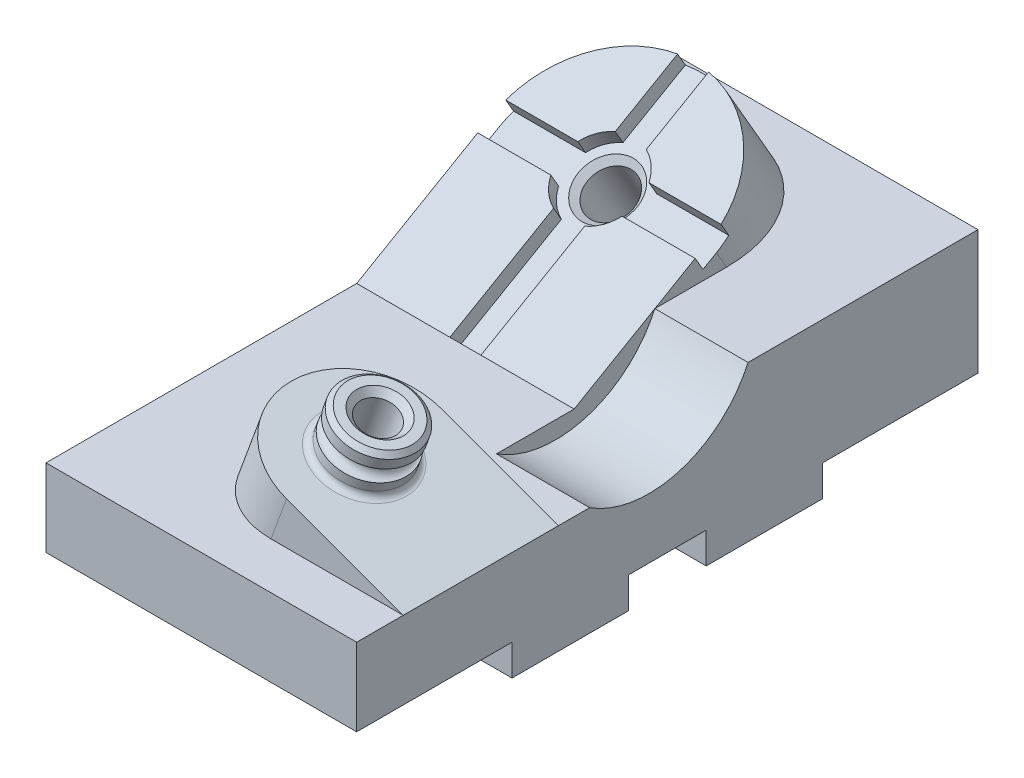
from build123d import *

# Parameters (mm, degrees)
BOSS_EXTRUDE1_DEPTH     = 100
CUT_EXTRUDE1_DEPTH      = 30
BOSS_EXTRUDE2_START     = -15
BOSS_EXTRUDE2_DEPTH     = 50
CUT_EXTRUDE2_REACH      = 226.87
SKETCH5_R               = 12.5
BOSS_EXTRUDE4_DEPTH     = 15
SKETCH7_R               = 6
CUT_EXTRUDE4_DEPTH      = 228.547988513
FILLET1_R               = 2
CHAMFER1_SIZE           = 2
CHAMFER2_SIZE           = 1.5
BOSS_EXTRUDE5_DEPTH     = 70
CUT_EXTRUDE5_REACH      = 232.227
CUT_EXTRUDE6_DEPTH      = 5
CUT_EXTRUDE7_DEPTH      = 230.919504684
CUT_EXTRUDE7_DEPTH_BACK = 230.919504684
SKETCH17_R              = 7.5
CHAMFER3_SIZE           = 2


with BuildPart() as part:
    # Sketch1 → Boss-Extrude1 (new body)
    with BuildSketch(Plane(origin=(0, 0, 0), x_dir=(0, 0, -1), z_dir=(1, 0, 0))):
        Polygon((0, 0), (50, 0), (50, -10), (87.5, -10), (87.5, 0), (112.5, 0), (112.5, -10), (150, -10), (150, 0), (200, 0), (200, 40), (125.980762114, 40), (100, 25), (0, 25), align=None)
    extrude(amount=BOSS_EXTRUDE1_DEPTH)

    # Sketch2 → Cut-Extrude1 (cut)
    with BuildSketch(Plane(origin=(100, 0, 0), x_dir=(0, 0, -1), z_dir=(1, 0, 0))):
        with BuildLine():
            Line((100, 25), (75, 25))
            ThreePointArc((75, 25), (103.939266476, 20.77821286), (125.980762114, 40))
            Line((125.980762114, 40), (100, 25))
        make_face()
    extrude(amount=-CUT_EXTRUDE1_DEPTH, mode=Mode.SUBTRACT)

    # Sketch3 → Boss-Extrude2 (add)
    with BuildSketch(Plane.XY.offset(BOSS_EXTRUDE2_START)):
        Polygon((100, 25), (30.828444789, 25), (38.919979649, 47.231309316), align=None)
    extrude(amount=-BOSS_EXTRUDE2_DEPTH)

    # Cut-Extrude2: up to this plane
    cut_extrude2_end = Plane(origin=(100, 25, 0), z_dir=(0, -1, 0))
    # Sketch4 → Cut-Extrude2 (cut, up to the surface)
    with BuildSketch(Plane(origin=(19.732622965, 54.214936023, 0), x_dir=(0.9396926207859106, -0.3420201433256628, 0), z_dir=(0.34202014332566283, 0.9396926207859106, 0)), mode=Mode.PRIVATE) as cut_extrude2_sk1:
        with BuildLine():
            ThreePointArc((20.418758495, 40), (27.741088966, 57.67766953), (45.418758495, 65))
            Line((45.418758495, 65), (20.418758495, 65))
            Line((20.418758495, 65), (20.418758495, 40))
        make_face()
    cut_extrude2_tool1 = split(extrude(cut_extrude2_sk1.sketch, amount=-CUT_EXTRUDE2_REACH, mode=Mode.PRIVATE), bisect_by=cut_extrude2_end, keep=Keep.BOTH, mode=Mode.PRIVATE)
    add(cut_extrude2_tool1.solids().sort_by_distance((44.16741, 45.321401, -59.415802))[0], mode=Mode.SUBTRACT)
    # Sketch4 → Cut-Extrude2 (cut, up to the surface)
    with BuildSketch(Plane(origin=(19.732622965, 54.214936023, 0), x_dir=(0.9396926207859106, -0.3420201433256628, 0), z_dir=(0.34202014332566283, 0.9396926207859106, 0)), mode=Mode.PRIVATE) as cut_extrude2_sk2:
        with BuildLine():
            ThreePointArc((45.418758495, 15), (27.741088966, 22.32233047), (20.418758495, 40))
            Line((20.418758495, 40), (20.418758495, 15))
            Line((20.418758495, 15), (45.418758495, 15))
        make_face()
    cut_extrude2_tool2 = split(extrude(cut_extrude2_sk2.sketch, amount=-CUT_EXTRUDE2_REACH, mode=Mode.PRIVATE), bisect_by=cut_extrude2_end, keep=Keep.BOTH, mode=Mode.PRIVATE)
    add(cut_extrude2_tool2.solids().sort_by_distance((44.16741, 45.321401, -20.584198))[0], mode=Mode.SUBTRACT)

    # Sketch5 → Boss-Extrude4 (add)
    with BuildSketch(Plane(origin=(19.732622965, 54.214936023, 0), x_dir=(0.9396926207859106, -0.3420201433256628, 0), z_dir=(0.34202014332566283, 0.9396926207859106, 0))):
        with Locations(Location((45.418758495, 40, 0), (0, 0, 180))):
            Circle(SKETCH5_R)
    extrude(amount=BOSS_EXTRUDE4_DEPTH)

    # Sketch7 → Cut-Extrude4 (cut, through all)
    with BuildSketch(Plane(origin=(24.862925115, 68.310325335, 0), x_dir=(0.9396926207859105, -0.3420201433256629, 0), z_dir=(0.34202014332566294, 0.9396926207859106, 0))):
        with Locations(Location((45.418758495, 40, 0), (0, 0, 180))):
            Circle(SKETCH7_R)
    extrude(amount=-CUT_EXTRUDE4_DEPTH, mode=Mode.SUBTRACT)

    # Fillet1
    fillet1_edges = [part.edges().sort_by_distance(p)[0] for p in [
        (74.158452928, 34.405553941, -40),
    ]]
    fillet(fillet1_edges, radius=FILLET1_R)

    # Chamfer1
    chamfer1_edges = [part.edges().sort_by_distance(p)[0] for p in [
        (73.180753043, 50.724074185, -40),
    ]]
    chamfer(chamfer1_edges, length=CHAMFER1_SIZE)

    # Sketch11 → Cut-Revolve1 (revolve, cut)
    with BuildSketch(Plane(origin=(42.679672203, -15.53413029, 0), x_dir=(0.34202014332566294, 0.9396926207859105, 0), z_dir=(0.9396926207859105, -0.342020143325663, 0)), mode=Mode.PRIVATE) as cut_revolve1_sk:
        with BuildLine():
            Line((67.694329852, -27.5), (62.694329852, -27.5))
            ThreePointArc((62.694329852, -27.5), (65.194329852, -30), (67.694329852, -27.5))
        make_face()
    revolve(cut_revolve1_sk.sketch.rotate(Axis((43.396560119, -13.564496931, -40), (0.34202014332566283, 0.9396926207859105, 0)), 90), axis=Axis((43.396560119, -13.564496931, -40), (0.34202014332566283, 0.9396926207859105, 0)), mode=Mode.SUBTRACT)

    # Chamfer2
    chamfer2_edges = [part.edges().sort_by_distance(p)[0] for p in [
        (79.288755078, 48.500943253, -40),
    ]]
    chamfer(chamfer2_edges, length=CHAMFER2_SIZE)

    # Sketch13 → Boss-Extrude5 (add)
    with BuildSketch(Plane.ZY):
        Polygon((-125.980762114, 40), (-173.612159322, 67.5), (-189.489291724, 40), align=None)
    extrude(amount=-BOSS_EXTRUDE5_DEPTH)

    # Cut-Extrude5: up to this plane
    cut_extrude5_end = Plane(origin=(100, 40, -200), z_dir=(0, -1, 0))
    # Sketch14 → Cut-Extrude5 (cut, up to the surface)
    with BuildSketch(Plane(origin=(0, -24.551270189, -14.174682453), x_dir=(1, 0, 0), z_dir=(0, 0.8660254037844378, 0.5000000000000016)), mode=Mode.PRIVATE) as cut_extrude5_sk1:
        with BuildLine():
            Line((70, 184.102540378), (35, 184.102540378))
            ThreePointArc((35, 184.102540378), (59.748737342, 173.85127772), (70, 149.102540378))
            Line((70, 149.102540378), (70, 184.102540378))
        make_face()
    cut_extrude5_tool1 = split(extrude(cut_extrude5_sk1.sketch, amount=-CUT_EXTRUDE5_REACH, mode=Mode.PRIVATE), bisect_by=cut_extrude5_end, keep=Keep.BOTH, mode=Mode.PRIVATE)
    add(cut_extrude5_tool1.solids().sort_by_distance((62.182122, 63.591061, -166.841678))[0], mode=Mode.SUBTRACT)
    # Sketch14 → Cut-Extrude5 (cut, up to the surface)
    with BuildSketch(Plane(origin=(0, -24.551270189, -14.174682453), x_dir=(1, 0, 0), z_dir=(0, 0.8660254037844378, 0.5000000000000016)), mode=Mode.PRIVATE) as cut_extrude5_sk2:
        with BuildLine():
            Line((0, 184.102540378), (0, 149.102540378))
            ThreePointArc((0, 149.102540378), (10.251262658, 173.85127772), (35, 184.102540378))
            Line((35, 184.102540378), (0, 184.102540378))
        make_face()
    cut_extrude5_tool2 = split(extrude(cut_extrude5_sk2.sketch, amount=-CUT_EXTRUDE5_REACH, mode=Mode.PRIVATE), bisect_by=cut_extrude5_end, keep=Keep.BOTH, mode=Mode.PRIVATE)
    add(cut_extrude5_tool2.solids().sort_by_distance((7.817878, 63.591061, -166.841678))[0], mode=Mode.SUBTRACT)

    # Sketch15 → Cut-Extrude6 (cut)
    with BuildSketch(Plane(origin=(0, -24.551270189, -14.174682453), x_dir=(1, 0, 0), z_dir=(0, 0.8660254037844378, 0.5000000000000016))):
        with BuildLine():
            ThreePointArc((40, 183.74355653), (35, 184.102540378), (30, 183.74355653))
            Line((30, 183.74355653), (30, 160.558979616))
            ThreePointArc((30, 160.558979616), (26.161165235, 157.941375143), (23.543560763, 154.102540378))
            Line((23.543560763, 154.102540378), (0.358983849, 154.102540378))
            ThreePointArc((0.358983849, 154.102540378), (0.08986132, 151.608975566), (0, 149.102540378))
            Line((0, 149.102540378), (0, 144.102540378))
            Line((0, 144.102540378), (23.543560763, 144.102540378))
            ThreePointArc((23.543560763, 144.102540378), (26.161165235, 140.263705614), (30, 137.646101141))
            Line((30, 137.646101141), (30, 99.102540378))
            Line((30, 99.102540378), (40, 99.102540378))
            Line((40, 99.102540378), (40, 137.646101141))
            ThreePointArc((40, 137.646101141), (43.838834765, 140.263705614), (46.456439237, 144.102540378))
            Line((46.456439237, 144.102540378), (70, 144.102540378))
            Line((70, 144.102540378), (70, 149.102540378))
            ThreePointArc((70, 149.102540378), (69.91013868, 151.608975566), (69.641016151, 154.102540378))
            Line((69.641016151, 154.102540378), (46.456439237, 154.102540378))
            ThreePointArc((46.456439237, 154.102540378), (43.838834765, 157.941375143), (40, 160.558979616))
            Line((40, 160.558979616), (40, 183.74355653))
        make_face()
    extrude(amount=-CUT_EXTRUDE6_DEPTH, mode=Mode.SUBTRACT)

    # Sketch17 → Cut-Extrude7 (cut, two sides: drawn at the far end of the back side and taken through both)
    with BuildSketch(Plane(origin=(0, -28.881397208, -16.674682453), x_dir=(1, 0, 0), z_dir=(0, 0.8660254037844378, 0.5000000000000016)).offset(-CUT_EXTRUDE7_DEPTH_BACK)):
        with Locations(Location((35, 149.102540378, 0), (0, 0, 270))):
            Circle(SKETCH17_R)
    extrude(amount=CUT_EXTRUDE7_DEPTH + CUT_EXTRUDE7_DEPTH_BACK, mode=Mode.SUBTRACT)

    # Chamfer3
    chamfer3_edges = [part.edges().sort_by_distance(p)[0] for p in [
        (35, 49.419872981, -152.296460718),
    ]]
    chamfer(chamfer3_edges, length=CHAMFER3_SIZE)


solid = part.part
